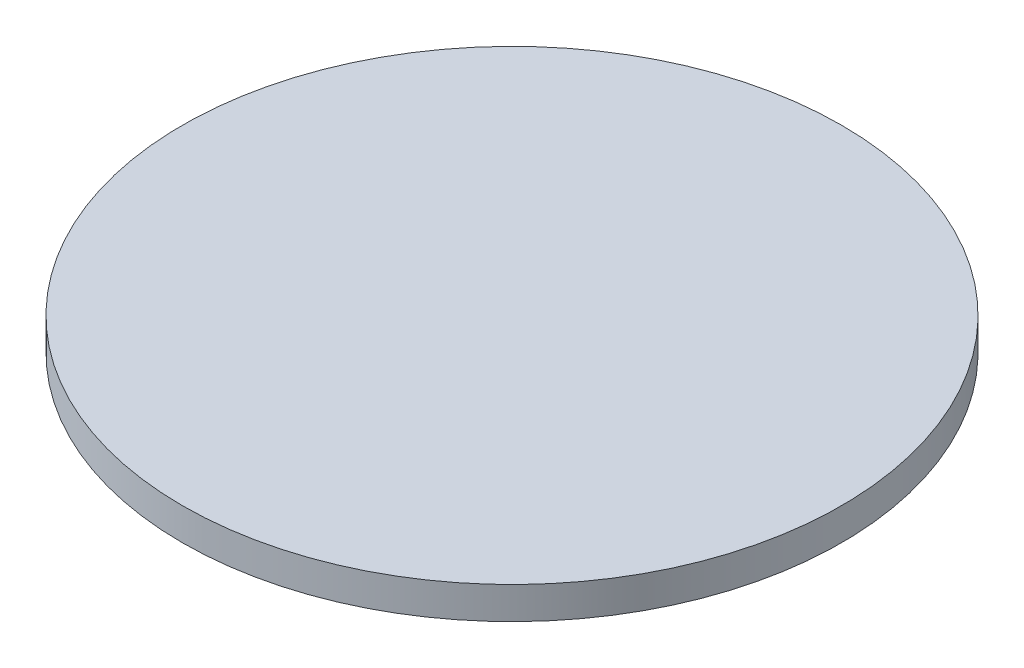
from build123d import *

# Parameters (mm, degrees)
SKETCH1_R           = 30.75
BOSS_EXTRUDE1_DEPTH = 3


with BuildPart() as part:
    # Sketch1 → Boss-Extrude1 (new body)
    with BuildSketch(Plane(origin=(0, 0, 0), x_dir=(1, 0, 0), z_dir=(0, 1, 0))):
        with Locations(Location((0, 0, 0), (0, 0, 270))):
            Circle(SKETCH1_R)
    extrude(amount=BOSS_EXTRUDE1_DEPTH)


solid = part.part
